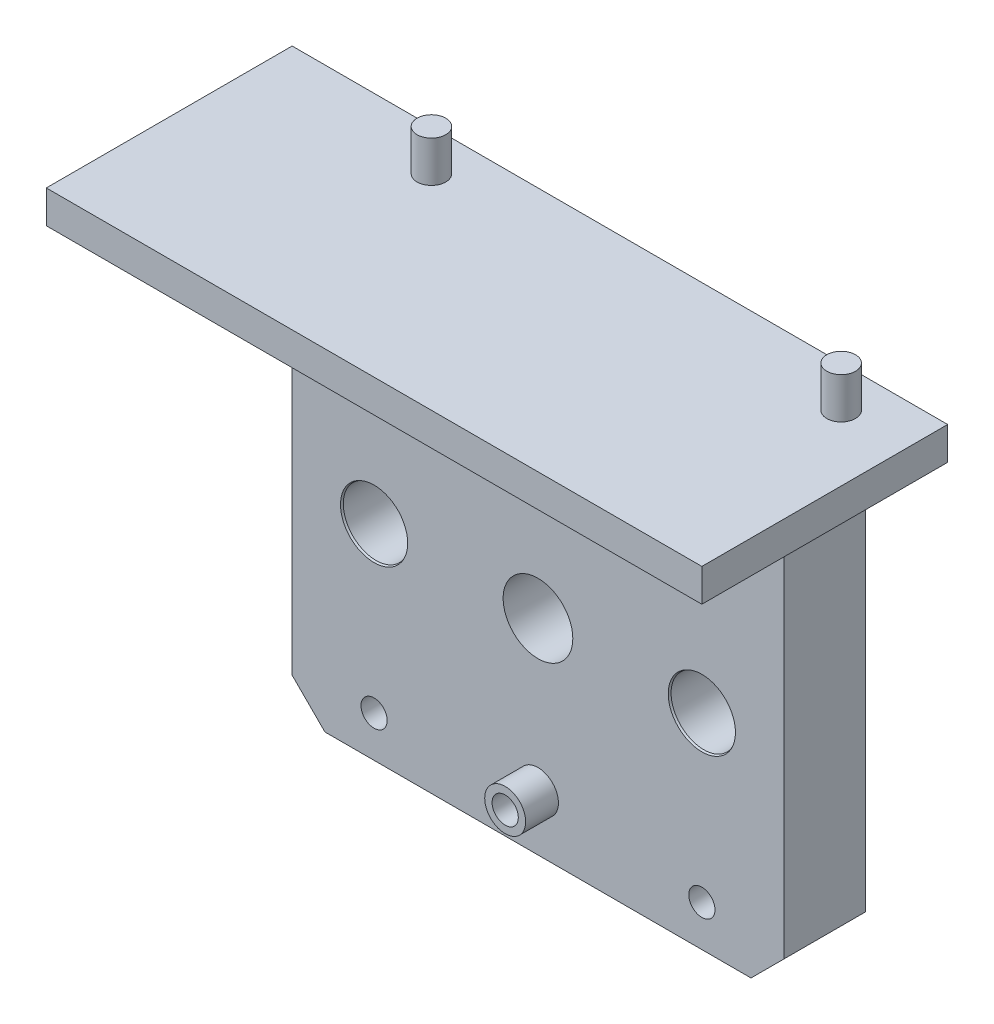
from build123d import *

# Parameters (mm, degrees)
SKETCH_1_W                = 60
SKETCH_1_H                = 50
EXTRUDE_1_DEPTH           = 10
HOLE_WIZARD_1_D           = 8.5
HOLE_WIZARD_1_DEPTH       = 20
HOLE_WIZARD_2_D           = 8
HOLE_WIZARD_2_CSINK_D     = 8.2
HOLE_WIZARD_2_CSINK_ANGLE = 45
SKETCH_9_R                = 2.5
EXTRUDE_3_DEPTH           = 4
HOLE_WIZARD_3_D           = 3.2
CHAMFER_1_SIZE            = 4
SKETCH_15_R               = 1.6
CUT_EXTRUDE_1_DEPTH       = 41.311288741
SKETCH_16_W               = 60
SKETCH_16_H               = 10
EXTRUDE_4_DEPTH           = 10.5
SKETCH_17_W               = 80
SKETCH_17_H               = 30
EXTRUDE_5_DEPTH           = 4
SKETCH_18_R               = 1.75
EXTRUDE_6_DEPTH           = 5


with BuildPart() as part:
    # 草图1 → 凸台-拉伸1 (new body)
    with BuildSketch(Plane.XY):
        Rectangle(SKETCH_1_W, SKETCH_1_H)
    extrude(amount=EXTRUDE_1_DEPTH)

    # 孔1
    with Locations(Plane.XY.offset(10)):
        with Locations((0, 0)):
            Hole(HOLE_WIZARD_1_D / 2, depth=HOLE_WIZARD_1_DEPTH)

    # 孔2 (through all)
    with Locations(Plane.XY.offset(10)):
        with Locations((20, 0), (-20, 0)):
            CounterSinkHole(HOLE_WIZARD_2_D / 2, HOLE_WIZARD_2_CSINK_D / 2, counter_sink_angle=HOLE_WIZARD_2_CSINK_ANGLE)

    # 草图9 → 凸台-拉伸3 (add)
    with BuildSketch(Plane.XY.offset(10)):
        with Locations(Location((0, 18.25, 0), (0, 0, 180))):
            Circle(SKETCH_9_R)
        with Locations(Location((0, -18.25, 0), (0, 0, 180))):
            Circle(SKETCH_9_R)
    extrude(amount=EXTRUDE_3_DEPTH)

    # 孔3 (through all)
    with Locations(Plane.XY.offset(14)):
        with Locations((0, 18.25), (0, -18.25)):
            Hole(HOLE_WIZARD_3_D / 2)

    # 倒角1
    chamfer_1_edges = [part.edges().sort_by_distance(p)[0] for p in [
        (30, -25, 5),
        (-30, -25, 5),
    ]]
    chamfer(chamfer_1_edges, length=CHAMFER_1_SIZE)

    # 草图15 → 切除-拉伸1 (cut, through all)
    with BuildSketch(Plane.XY.offset(10)):
        with BuildLine():
            ThreePointArc((-21.13137085, 21.13137085), (-21.13137085, 18.86862915), (-18.86862915, 18.86862915))
            Line((-18.86862915, 18.86862915), (-21.13137085, 21.13137085))
        make_face()
        with BuildLine():
            Line((-21.13137085, 21.13137085), (-18.86862915, 18.86862915))
            ThreePointArc((-18.86862915, 18.86862915), (-18.521792748, 19.387706508), (-18.4, 20))
            ThreePointArc((-18.4, 20), (-19.387706508, 21.478207252), (-21.13137085, 21.13137085))
        make_face()
        with Locations((20, 20)):
            Circle(SKETCH_15_R)
        with Locations((20, -20)):
            Circle(SKETCH_15_R)
        with Locations(Location((-20, -20, 0), (0, 0, 180))):
            Circle(SKETCH_15_R)
    extrude(amount=-CUT_EXTRUDE_1_DEPTH, mode=Mode.SUBTRACT)

    # 草图16 → 凸台-拉伸4 (add)
    with BuildSketch(Plane(origin=(0, 25, 0), x_dir=(1, 0, 0), z_dir=(0, 1, 0))):
        with Locations((0, -5)):
            Rectangle(SKETCH_16_W, SKETCH_16_H)
    extrude(amount=EXTRUDE_4_DEPTH)

    # 草图17 → 凸台-拉伸5 (add)
    with BuildSketch(Plane(origin=(0, 35.5, 0), x_dir=(1, 0, 0), z_dir=(0, 1, 0))):
        with Locations((0, -15)):
            Rectangle(SKETCH_17_W, SKETCH_17_H)
    extrude(amount=-EXTRUDE_5_DEPTH)

    # 草图18 → 凸台-拉伸6 (add)
    with BuildSketch(Plane(origin=(0, 35.5, 0), x_dir=(1, 0, 0), z_dir=(0, 1, 0))):
        with Locations(Location((32, -5, 0), (0, 0, 270))):
            Circle(SKETCH_18_R)
        with Locations(Location((-18, -5, 0), (0, 0, 270))):
            Circle(SKETCH_18_R)
    extrude(amount=EXTRUDE_6_DEPTH)


solid = part.part
